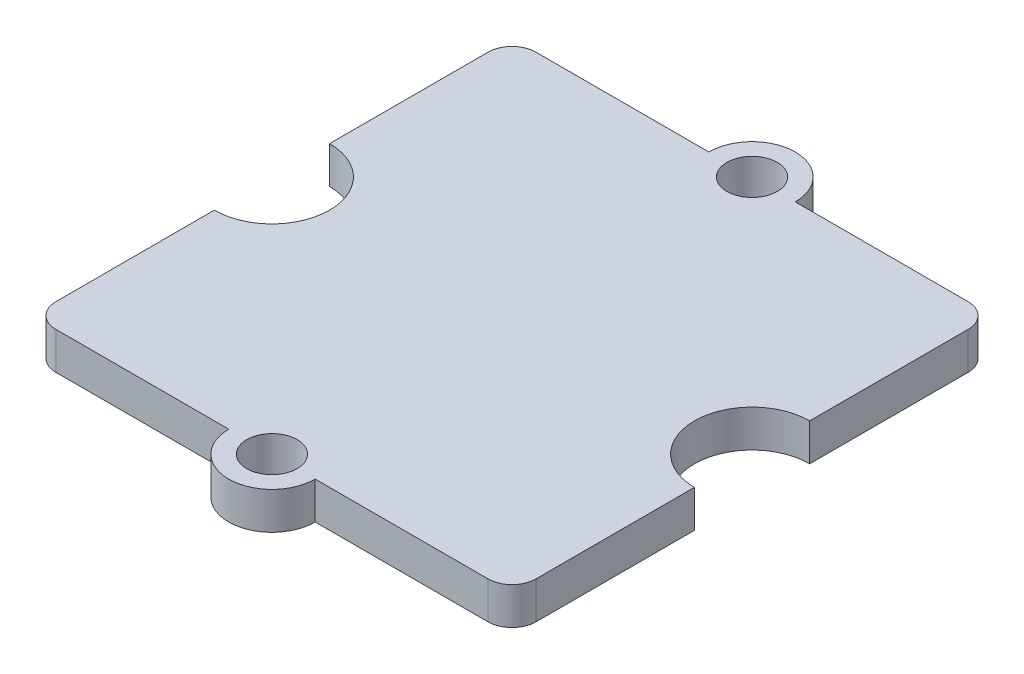
from build123d import *

# Parameters (mm, degrees)
ESQUISSE1_R        = 1.05
BOSS_EXTRU_1_DEPTH = 1.55


with BuildPart() as part:
    # Esquisse1 → Boss.-Extru.1 (new body)
    with BuildSketch(Plane(origin=(0, 0, 0), x_dir=(1, 0, 0), z_dir=(0, 1, 0))):
        with BuildLine():
            Line((1, 0), (8.2, 0))
            ThreePointArc((8.2, 0), (10, -1.8), (11.8, 0))
            Line((11.8, 0), (19, 0))
            ThreePointArc((19, 0), (19.707106781, 0.292893219), (20, 1))
            Line((20, 1), (20, 7.6))
            ThreePointArc((20, 7.6), (17.6, 10), (20, 12.4))
            Line((20, 12.4), (20, 19))
            ThreePointArc((20, 19), (19.707106781, 19.707106781), (19, 20))
            Line((19, 20), (11.8, 20))
            ThreePointArc((11.8, 20), (10, 21.8), (8.2, 20))
            Line((8.2, 20), (1, 20))
            ThreePointArc((1, 20), (0.292893219, 19.707106781), (0, 19))
            Line((0, 19), (0, 12.4))
            ThreePointArc((0, 12.4), (2.4, 10), (0, 7.6))
            Line((0, 7.6), (0, 1))
            ThreePointArc((0, 1), (0.292893219, 0.292893219), (1, 0))
        make_face()
        with Locations(Location((10, 0, 0), (0, 0, 90))):
            Circle(ESQUISSE1_R, mode=Mode.SUBTRACT)
        with Locations(Location((10, 20, 0), (0, 0, 90))):
            Circle(ESQUISSE1_R, mode=Mode.SUBTRACT)
    extrude(amount=BOSS_EXTRU_1_DEPTH)


solid = part.part
